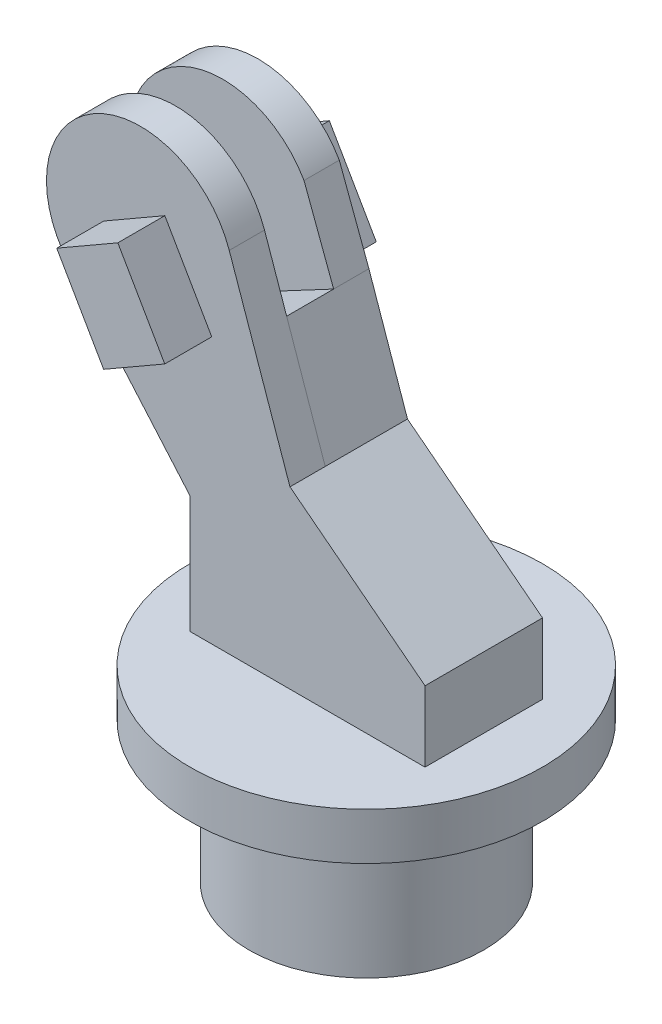
from build123d import *

# Parameters (mm, degrees)
BOSS_EXTRUDE3_DEPTH  = 38.1
BOSS_EXTRUDE4_START  = -38.1
SKETCH2_R            = 101.6
SKETCH2_R_2          = 63.5
BOSS_EXTRUDE4_DEPTH  = 38.1
BOSS_EXTRUDE5_START  = -127
BOSS_EXTRUDE5_DEPTH  = 127
BOSS_EXTRUDE7_START  = 88.9
BOSS_EXTRUDE7_DEPTH  = 88.9
BOSS_EXTRUDE8_DEPTH  = 38.1
SKETCH9_R            = 190.5
BOSS_EXTRUDE9_DEPTH  = 50.8
SKETCH15_R           = 127
BOSS_EXTRUDE10_DEPTH = 152.4
SKETCH16_R           = 12.7
BOSS_EXTRUDE11_DEPTH = 50.8
SKETCH17_R           = 63.5
CUT_EXTRUDE1_DEPTH   = 25.4
BOSS_EXTRUDE12_DEPTH = 50.8


with BuildPart() as part:
    # Sketch1 → Boss-Extrude3 (new body)
    with BuildSketch(Plane.XY):
        with BuildLine():
            ThreePointArc((0, 175.976362049), (-66.179327011, 80.750651629), (-178.502675689, 109.579536282))
            Line((-178.502675689, 109.579536282), (-48.064172306, -41.498016104))
            ThreePointArc((-48.064172306, -41.498016104), (-31.75, 54.99261314), (59.970422306, 20.875786176))
            Line((59.970422306, 20.875786176), (-5.647324311, 209.377619931))
            ThreePointArc((-5.647324311, 209.377619931), (-1.421779188, 192.914014631), (0, 175.976362049))
        make_face()
    extrude(amount=BOSS_EXTRUDE3_DEPTH)

    # Sketch2 → Boss-Extrude4 (add)
    with BuildSketch(Plane.XY.offset(38.1).offset(BOSS_EXTRUDE4_START)):
        with Locations((-101.6, 175.976362049)):
            Circle(SKETCH2_R)
        Circle(SKETCH2_R_2)
    extrude(amount=BOSS_EXTRUDE4_DEPTH)

    # Sketch3 → Boss-Extrude5 (add)
    with BuildSketch(Plane.XY.offset(38.1).offset(BOSS_EXTRUDE5_START)):
        with BuildLine():
            Line((-48.064172306, -41.498016104), (-48.064172306, -168.498016104))
            Line((-48.064172306, -168.498016104), (205.935827694, -168.498016104))
            Line((205.935827694, -168.498016104), (205.935827694, -92.298016104))
            Line((205.935827694, -92.298016104), (59.970422306, 20.875786176))
            ThreePointArc((59.970422306, 20.875786176), (31.75, -54.99261314), (-48.064172306, -41.498016104))
        make_face()
    extrude(amount=BOSS_EXTRUDE5_DEPTH)

    # Sketch4 → Boss-Extrude7 (add)
    with BuildSketch(Plane(origin=(0, 0, 0), x_dir=(-1, 0, 0), z_dir=(0, 0, -1)).offset(BOSS_EXTRUDE7_START)):
        with BuildLine():
            Line((-60.014697878, 20.748157474), (-18.263261234, 140.689049326))
            Line((-18.263261234, 140.689049326), (134.985164693, 59.176328053))
            Line((134.985164693, 59.176328053), (51.773850531, -36.765723184))
            ThreePointArc((51.773850531, -36.765723184), (-29.050636969, -56.465126332), (-60.014697878, 20.748157474))
        make_face()
    extrude(amount=-BOSS_EXTRUDE7_DEPTH)

    # Sketch11 → Boss-Extrude8 (add)
    with BuildSketch(Plane(origin=(0, 0, -88.9), x_dir=(-1, 0, 0), z_dir=(0, 0, -1))):
        with BuildLine():
            Line((13.737038838, 226.313954509), (-18.263261234, 140.689049326))
            Line((-18.263261234, 140.689049326), (134.985164693, 59.176328053))
            Line((134.985164693, 59.176328053), (189.462961162, 125.638769589))
            ThreePointArc((189.462961162, 125.638769589), (151.93759246, 263.839323211), (13.737038838, 226.313954509))
        make_face()
    extrude(amount=-BOSS_EXTRUDE8_DEPTH)

    # Sketch9 → Boss-Extrude9 (add)
    with BuildSketch(Plane(origin=(0, -168.498016104, 0), x_dir=(-1, 0, 0), z_dir=(0, -1, 0))):
        with Locations(Location((-78.935827694, 25.4, 0), (0, 0, 90))):
            Circle(SKETCH9_R)
    extrude(amount=BOSS_EXTRUDE9_DEPTH)

    # Sketch15 → Boss-Extrude10 (add)
    with BuildSketch(Plane.XZ.offset(219.298016104)):
        with Locations(Location((78.692071522, -25.762296975, 0), (0, 0, 90))):
            Circle(SKETCH15_R)
    extrude(amount=BOSS_EXTRUDE10_DEPTH)

    # Sketch16 → Boss-Extrude11 (add)
    with BuildSketch(Plane.XY.offset(-50.8)):
        with Locations(Location((-101.6, 175.976362049, 0), (0, 0, 180))):
            Circle(SKETCH16_R)
    extrude(amount=BOSS_EXTRUDE11_DEPTH)

    # Sketch17 → Cut-Extrude1 (cut)
    with BuildSketch(Plane.XZ.offset(371.698016104)):
        with Locations(Location((78.692071522, -25.762296975, 0), (0, 0, 270))):
            Circle(SKETCH17_R)
    extrude(amount=-CUT_EXTRUDE1_DEPTH, mode=Mode.SUBTRACT)

    # Sketch19 → Boss-Extrude12 (add)
    with BuildSketch(Plane.XY.offset(38.1)):
        Polygon((-24.564880981, 119.003650496), (-75.267213011, 207.048147921), (-141.300586079, 169.021398898), (-90.598254049, 80.976901474), align=None)
    boss_extrude12 = extrude(amount=BOSS_EXTRUDE12_DEPTH)

    # Mirror1: Boss-Extrude12 across plane
    add(boss_extrude12.mirror(Plane(origin=(0, 0, -25.4), x_dir=(1, 0, 0), z_dir=(0, 0, -1))))


solid = part.part
